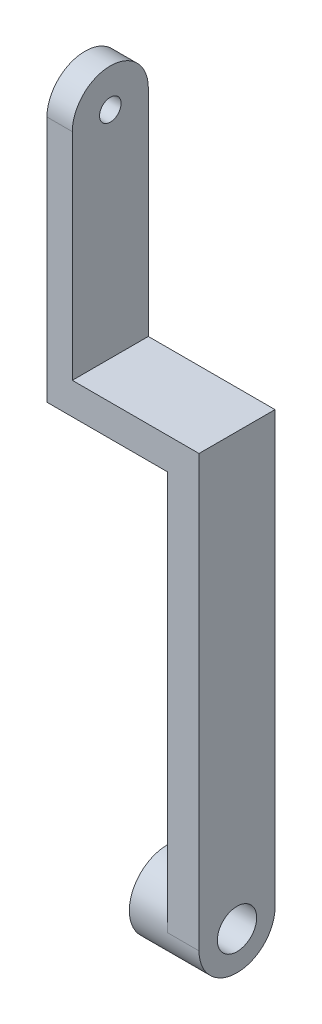
from build123d import *
from build123d.topology import SkipClean

# Parameters (mm, degrees)
EXTRUDE_1_DEPTH     = 6
FILLET_3_RADIUS     = 3
FILLET_3_LENGTH     = 2
FILLET_4_RADIUS     = 3
FILLET_4_LENGTH     = 2.5
SKETCH_2_R          = 0.85
SKETCH_2_R_2        = 1.55
CUT_EXTRUDE_1_DEPTH = 40.357337308
EXTRUDE_START       = 3
SKETCH_3_R          = 3
SKETCH_3_R_2        = 1.55
EXTRUDE_2_DEPTH     = 3


with BuildPart() as part:
    # 草图1 → 凸台-拉伸1 (new body)
    with BuildSketch(Plane.XY):
        Polygon((-2, -2.5), (7.5, -2.5), (7.5, -37), (10, -37), (10, 0), (0, 0), (0, 20), (-2, 20), (-2, 8.273638366), align=None)
    extrude(amount=EXTRUDE_1_DEPTH)

    # 圆角3: full round fillet: the end face becomes a half cylinder, R = half its width
    fillet_3_face = Plane((-1, 20, 3), x_dir=(-1, 0, 0), z_dir=(0, 1, 0))  # on the end face: x along it, z out of the body
    fillet_3_slab = fillet_3_face.offset(-FILLET_3_RADIUS / 2) * Box(FILLET_3_LENGTH, 2 * FILLET_3_RADIUS, FILLET_3_RADIUS, mode=Mode.PRIVATE)  # the body's end, R deep
    fillet_3_round = Plane((-1, 17, 3), x_dir=(0, 1, 0), z_dir=(-1, 0, 0)) * Cylinder(FILLET_3_RADIUS, FILLET_3_LENGTH, mode=Mode.PRIVATE)  # its axis R under the face
    add(fillet_3_slab - fillet_3_round, mode=Mode.SUBTRACT)

    # 圆角4: full round fillet: the end face becomes a half cylinder, R = half its width
    fillet_4_face = Plane((8.75, -37, 3), x_dir=(-1, 0, 0), z_dir=(0, -1, 0))  # on the end face: x along it, z out of the body
    fillet_4_slab = fillet_4_face.offset(-FILLET_4_RADIUS / 2) * Box(FILLET_4_LENGTH, 2 * FILLET_4_RADIUS, FILLET_4_RADIUS, mode=Mode.PRIVATE)  # the body's end, R deep
    fillet_4_round = Plane((8.75, -34, 3), x_dir=(0, -1, 0), z_dir=(-1, 0, 0)) * Cylinder(FILLET_4_RADIUS, FILLET_4_LENGTH, mode=Mode.PRIVATE)  # its axis R under the face
    add(fillet_4_slab - fillet_4_round, mode=Mode.SUBTRACT)

    # 草图2 → 切除-拉伸1 (cut, through all)
    with BuildSketch(Plane.ZY.offset(2)):
        with Locations(Location((3, 17, 0), (0, 0, 270))):
            Circle(SKETCH_2_R)
        with Locations(Location((3, -34, 0), (0, 0, 270))):
            Circle(SKETCH_2_R_2)
    extrude(amount=-CUT_EXTRUDE_1_DEPTH, mode=Mode.SUBTRACT)

    # 草图3 → 凸台-拉伸2 (add)
    with SkipClean():  # the faces are left unmerged after this step: merging them gives an invalid solid
        with BuildSketch(Plane.ZY.offset(-7.5).offset(EXTRUDE_START)):
            with Locations(Location((3, -34, 0), (0, 0, 180))):
                Circle(SKETCH_3_R)
            with Locations(Location((3, -34, 0), (0, 0, 270))):
                Circle(SKETCH_3_R_2, mode=Mode.SUBTRACT)
        extrude(amount=-EXTRUDE_2_DEPTH)


solid = part.part
